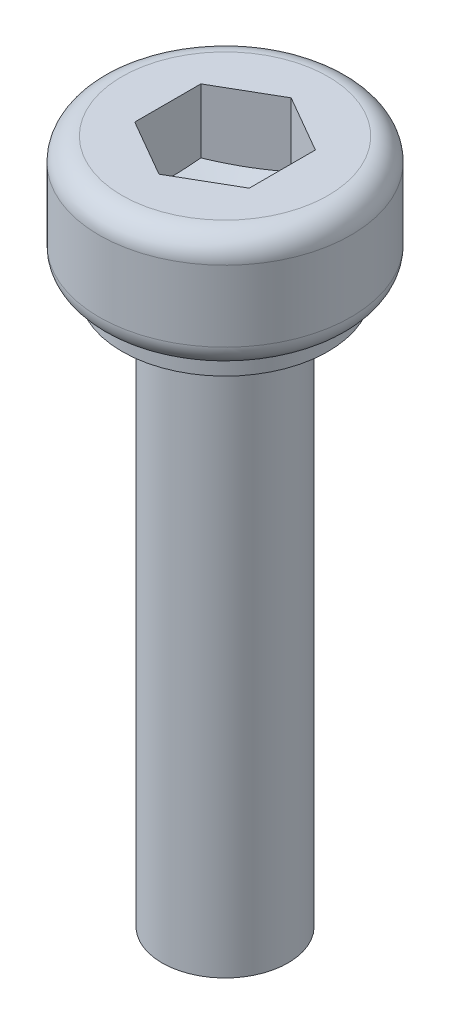
from build123d import *

# Parameters (mm, degrees)
BOSS_EXTRUDE1_DEPTH = 2


with BuildPart() as part:
    # Sketch1 → Revolve1 (revolve)
    with BuildSketch(Plane.XY):
        with BuildLine():
            Line((0, 7.475), (2.25, 7.475))
            ThreePointArc((2.25, 7.475), (2.603553391, 7.328553391), (2.75, 6.975))
            Line((2.75, 6.975), (2.75, 5.425))
            ThreePointArc((2.75, 5.425), (2.603553391, 5.071446609), (2.25, 4.925))
            Line((2.25, 4.925), (2.25, 4.525))
            Line((2.25, 4.525), (1.375, 4.525))
            Line((1.375, 4.525), (1.375, -7.475))
            Line((1.375, -7.475), (0, -7.475))
            Line((0, -7.475), (0, 7.475))
        make_face()
    revolve(axis=Axis((0, 4.094224924, 0), (0, -1, 0)))


with BuildPart() as body_2:
    # Sketch2 → Boss-Extrude1 (new body)
    with BuildSketch(Plane(origin=(0, 7.475, 0), x_dir=(1, 0, 0), z_dir=(0, 1, 0))):
        Polygon((0, 1.443375673), (-1.25, 0.721687836), (-1.25, -0.721687836), (0, -1.443375673), (1.25, -0.721687836), (1.25, 0.721687836), align=None)
    extrude(amount=-BOSS_EXTRUDE1_DEPTH)

    # Sketch3 → Cut-Revolve1 (revolve, cut)
    with BuildSketch(Plane(origin=(0, 0, 0), x_dir=(0, 0, -1), z_dir=(1, 0, 0))):
        Polygon((0, 5.875), (0.4, 5.875), (1.443375673, 6.075), (1.443375673, 5.475), (0, 5.475), align=None)
    revolve(axis=Axis((0, 5.475, 0), (0, 1, 0)), mode=Mode.SUBTRACT)


with BuildPart() as part_1:
    add(part.part)

    # Combine1: cut body 2
    add(body_2.part, mode=Mode.SUBTRACT)


solid = part_1.part
